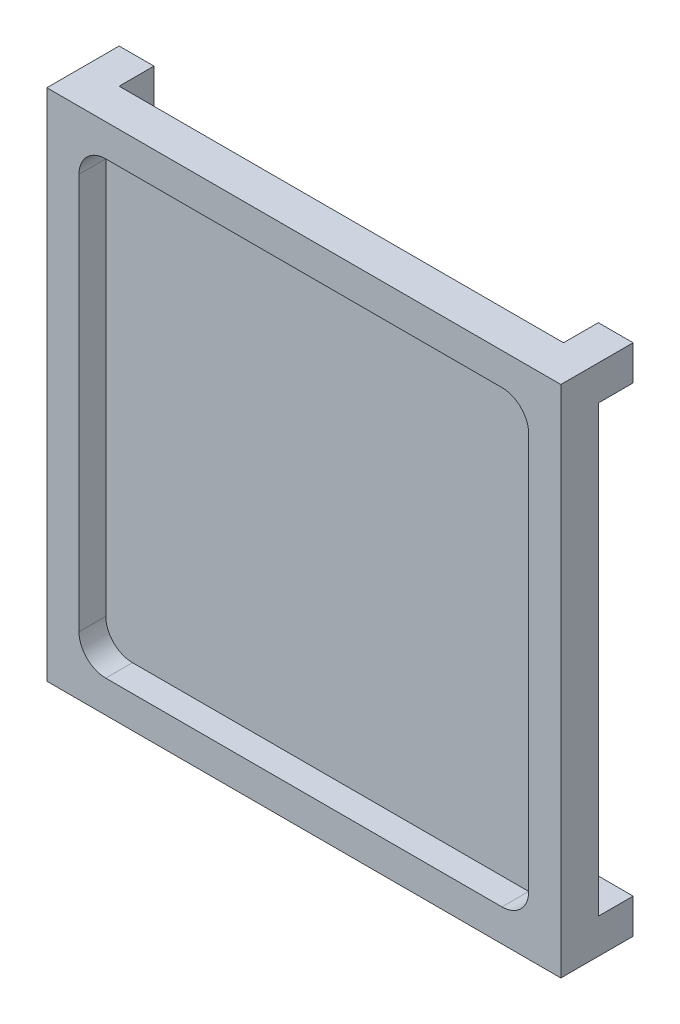
from build123d import *

# Parameters (mm, degrees)
SKETCH1_W           = 96
SKETCH1_H           = 96
BOSS_EXTRUDE1_DEPTH = 2
SKETCH2_W           = 96
SKETCH2_H           = 96
BOSS_EXTRUDE2_DEPTH = 5
SKETCH3_W           = 6.5
SKETCH3_H           = 6.5
BOSS_EXTRUDE3_DEPTH = 6.5


with BuildPart() as part:
    # Sketch1 → Boss-Extrude1 (new body)
    with BuildSketch(Plane.XY):
        Rectangle(SKETCH1_W, SKETCH1_H)
    extrude(amount=BOSS_EXTRUDE1_DEPTH)

    # Sketch2 → Boss-Extrude2 (add)
    with BuildSketch(Plane.XY.offset(2)):
        Rectangle(SKETCH2_W, SKETCH2_H)
        with BuildLine():
            Line((37, -42), (-37, -42))
            ThreePointArc((-37, -42), (-40.535533906, -40.535533906), (-42, -37))
            Line((-42, -37), (-42, 37))
            ThreePointArc((-42, 37), (-40.535533906, 40.535533906), (-37, 42))
            Line((-37, 42), (37, 42))
            ThreePointArc((37, 42), (40.535533906, 40.535533906), (42, 37))
            Line((42, 37), (42, -37))
            ThreePointArc((42, -37), (40.535533906, -40.535533906), (37, -42))
        make_face(mode=Mode.SUBTRACT)
    extrude(amount=BOSS_EXTRUDE2_DEPTH)

    # Sketch3 → Boss-Extrude3 (add)
    with BuildSketch(Plane(origin=(0, 0, 0), x_dir=(-1, 0, 0), z_dir=(0, 0, -1))):
        with Locations((-44.75, 44.75)):
            Rectangle(SKETCH3_W, SKETCH3_H)
        with Locations((44.75, 44.75)):
            Rectangle(SKETCH3_W, SKETCH3_H)
        with Locations((-44.75, -44.75)):
            Rectangle(SKETCH3_W, SKETCH3_H)
        with Locations((44.75, -44.75)):
            Rectangle(SKETCH3_W, SKETCH3_H)
    extrude(amount=BOSS_EXTRUDE3_DEPTH)


solid = part.part
